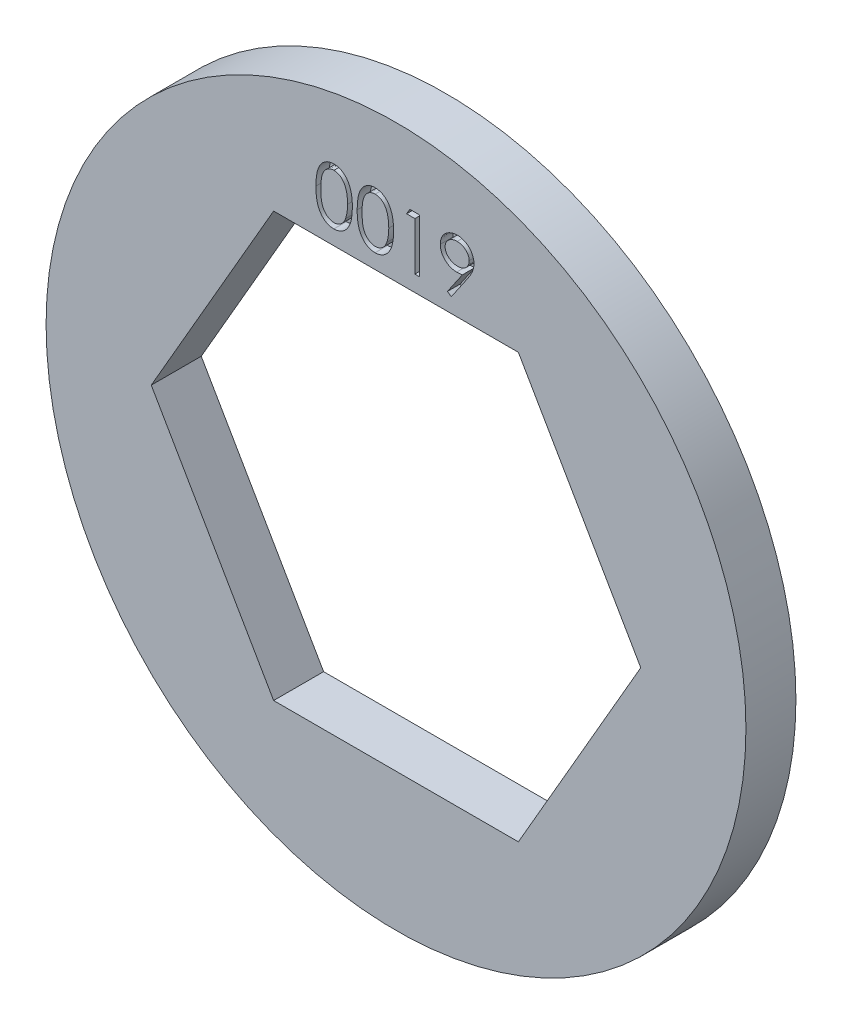
from build123d import *

# Parameters (mm, degrees)
SKETCH1_R           = 11.1125
BOSS_EXTRUDE1_DEPTH = 1.5875
CUT_EXTRUDE1_DEPTH  = 0.4


with BuildPart() as part:
    # Sketch1 → Boss-Extrude1 (new body)
    with BuildSketch(Plane.XY):
        Circle(SKETCH1_R)
        Polygon((7.772289324, 0), (3.886144662, 6.731), (-3.886144662, 6.731), (-7.772289324, 0), (-3.886144662, -6.731), (3.886144662, -6.731), align=None, mode=Mode.SUBTRACT)
    extrude(amount=BOSS_EXTRUDE1_DEPTH)

    # Sketch2 → Cut-Extrude1 (cut)
    # profile 1 of 4: a face of its own
    with BuildSketch(Plane.XY.offset(1.5875)):
        with BuildLine():
            add(Edge.make_bspline(
                [(-2.542411944, 8.089218189), (-2.542252452, 8.116494342), (-2.541942637, 8.169478662), (-2.538496044, 8.246684291), (-2.532770537, 8.31911304), (-2.524924085, 8.386768374), (-2.515375538, 8.44966776), (-2.502628819, 8.507643106), (-2.488132983, 8.560962739), (-2.471332596, 8.609800533), (-2.452375619, 8.654814457), (-2.431742869, 8.69683686), (-2.408615507, 8.735804157), (-2.384315304, 8.772338297), (-2.357858601, 8.805841242), (-2.329998292, 8.836786123), (-2.299646992, 8.864457756), (-2.267836456, 8.88966691), (-2.234278679, 8.911765741), (-2.199930196, 8.931230803), (-2.164554585, 8.947859755), (-2.128055262, 8.960934654), (-2.090760287, 8.971734202), (-2.052539286, 8.979119502), (-2.01332915, 8.983766344), (-1.986863032, 8.984210596), (-1.97344075, 8.984435897)],
                knots=[0, 0, 0, 0, 1.646270934, 3.197905019, 4.663502075, 6.030701355, 7.308322542, 8.50163776, 9.611534131, 10.641858119, 11.616356847, 12.558055219, 13.465016945, 14.349605745, 15.204443733, 16.039544428, 16.859896111, 17.680448484, 18.487036065, 19.28249412, 20.06191084, 20.843045899, 21.620316918, 22.403196591, 23.190181807, 24, 24, 24, 24], degree=3))
            add(Edge.make_bspline(
                [(-1.97344075, 8.984435897), (-1.959906345, 8.984198708), (-1.932990672, 8.983727012), (-1.893197543, 8.979193445), (-1.854323724, 8.971670943), (-1.816534944, 8.961012339), (-1.779520801, 8.947789024), (-1.743570807, 8.931214893), (-1.708461661, 8.911921894), (-1.674751294, 8.889252033), (-1.642069628, 8.863976765), (-1.611219415, 8.835404677), (-1.582197849, 8.803824268), (-1.554640696, 8.769573421), (-1.529329778, 8.731995204), (-1.505225758, 8.691743205), (-1.483650807, 8.648113495), (-1.462871987, 8.601834032), (-1.44493648, 8.55162429), (-1.428761481, 8.497767299), (-1.415692158, 8.439626913), (-1.404805855, 8.377508176), (-1.396372271, 8.311182961), (-1.390229919, 8.240793442), (-1.386985274, 8.16629331), (-1.38637423, 8.115357051), (-1.386060662, 8.089218189)],
                knots=[0, 0, 0, 0, 0.810914788, 1.612654377, 2.396697861, 3.181598691, 3.963628158, 4.749916497, 5.551656086, 6.361998678, 7.18212741, 8.025565596, 8.878627764, 9.750805457, 10.657531673, 11.591944965, 12.560506719, 13.57287815, 14.630710178, 15.753379473, 16.941251878, 18.199788006, 19.531962791, 20.947069417, 22.433333509, 24, 24, 24, 24], degree=3))
            add(Edge.make_bspline(
                [(-1.386060662, 8.089218189), (-1.386377481, 8.063193336), (-1.38699479, 8.01248497), (-1.390193545, 7.938320052), (-1.396494402, 7.868304089), (-1.404376161, 7.802269162), (-1.415292461, 7.740490118), (-1.428714882, 7.682753174), (-1.443617944, 7.628808997), (-1.462014302, 7.57909951), (-1.482149373, 7.53293127), (-1.504056496, 7.489818769), (-1.527526665, 7.449380941), (-1.553096815, 7.411941464), (-1.580351586, 7.377235122), (-1.60987431, 7.345874535), (-1.640832768, 7.317104064), (-1.67361061, 7.291503338), (-1.707846718, 7.269095589), (-1.742835278, 7.249056238), (-1.779197095, 7.232897552), (-1.816108142, 7.219023), (-1.854096386, 7.208422997), (-1.893114474, 7.201093658), (-1.932963937, 7.195953323), (-1.959901761, 7.195561189), (-1.97344075, 7.195364103)],
                knots=[0, 0, 0, 0, 1.561518951, 3.042555995, 4.452378317, 5.7783523, 7.031515105, 8.214008947, 9.334062868, 10.386615937, 11.391082383, 12.354592575, 13.286541444, 14.194233754, 15.072674879, 15.931287219, 16.775624067, 17.606195743, 18.42308326, 19.229000347, 20.022332153, 20.807536673, 21.593273796, 22.3848459, 23.188221202, 24, 24, 24, 24], degree=3))
            add(Edge.make_bspline(
                [(-1.97344075, 7.195364103), (-1.986862659, 7.195590858), (-2.013328044, 7.196037975), (-2.052543557, 7.200663823), (-2.090606718, 7.208100934), (-2.127705352, 7.218514299), (-2.164029794, 7.231260701), (-2.199085069, 7.247867198), (-2.233260949, 7.266992546), (-2.266466254, 7.28877336), (-2.298077025, 7.313727429), (-2.328271141, 7.341327848), (-2.356290072, 7.372263368), (-2.382368501, 7.406045519), (-2.407153559, 7.442363508), (-2.429952512, 7.481713195), (-2.451040661, 7.523938553), (-2.470316459, 7.569312388), (-2.487406743, 7.618496804), (-2.502503026, 7.672054482), (-2.51442251, 7.730458136), (-2.524625022, 7.793238689), (-2.532854141, 7.860665916), (-2.538472184, 7.932776422), (-2.541944495, 8.009525273), (-2.542253284, 8.062169131), (-2.542411944, 8.089218189)],
                knots=[0, 0, 0, 0, 0.810891512, 1.598919785, 2.382837074, 3.152667961, 3.926044502, 4.706494248, 5.493654104, 6.291793342, 7.103789334, 7.925228297, 8.761435821, 9.622817696, 10.50288917, 11.416980706, 12.369136599, 13.353924996, 14.394355917, 15.514179734, 16.714354668, 17.994756427, 19.357759367, 20.818452758, 22.365282078, 24, 24, 24, 24], degree=3))
        make_face()
        with BuildLine():
            add(Edge.make_bspline(
                [(-2.389686303, 8.0899), (-2.389628225, 8.067169447), (-2.389515505, 8.023053907), (-2.386570808, 7.958947946), (-2.382559309, 7.899156259), (-2.377385206, 7.843602925), (-2.369701361, 7.792475985), (-2.361091815, 7.7454238), (-2.350614518, 7.702695377), (-2.338218112, 7.663997509), (-2.324098474, 7.628673456), (-2.308682177, 7.595803814), (-2.29212088, 7.565000293), (-2.27358626, 7.53653958), (-2.25340045, 7.510328863), (-2.232019395, 7.485904224), (-2.208645131, 7.464122652), (-2.176309112, 7.43799912), (-2.133619957, 7.411004131), (-2.079833131, 7.387496881), (-2.024564283, 7.372724063), (-1.987051141, 7.370845394), (-1.968327169, 7.369907692)],
                knots=[0, 0, 0, 0, 1.459021318, 2.831673884, 4.118529203, 5.306027144, 6.411944654, 7.436330062, 8.375795394, 9.233974572, 10.042671642, 10.816086306, 11.563610507, 12.285937304, 12.993564865, 13.685989202, 14.367179055, 15.041617293, 16.353048772, 17.594441528, 18.799311195, 20, 20, 20, 20], degree=3))
            add(Edge.make_bspline(
                [(-1.968327169, 7.369907692), (-1.949482081, 7.370684579), (-1.911830815, 7.372236748), (-1.856821931, 7.387211974), (-1.803419316, 7.409806792), (-1.761568679, 7.436523839), (-1.729729196, 7.461967368), (-1.706916815, 7.483660285), (-1.685978816, 7.507950255), (-1.666120233, 7.534157633), (-1.64790656, 7.562783116), (-1.631344089, 7.593689057), (-1.616230477, 7.626961278), (-1.607619833, 7.65018829), (-1.603217433, 7.662063662)],
                knots=[0, 0, 0, 0, 1.353760809, 2.704726607, 4.075137775, 5.516104923, 6.260822281, 7.007110065, 7.778089737, 8.566572457, 9.372053459, 10.217411131, 11.088608312, 12, 12, 12, 12], degree=3))
            add(Edge.make_bspline(
                [(-1.603217433, 7.662063662), (-1.598086862, 7.677248453), (-1.587669603, 7.708080093), (-1.574243969, 7.755907311), (-1.563670735, 7.806087443), (-1.554158467, 7.858320604), (-1.54766583, 7.912991999), (-1.542439936, 7.969932469), (-1.539361775, 8.029184945), (-1.538980207, 8.069442235), (-1.538786303, 8.0899)],
                knots=[0, 0, 0, 0, 0.884706709, 1.796334032, 2.740027952, 3.714592787, 4.726048262, 5.777819803, 6.87074269, 8, 8, 8, 8], degree=3))
            add(Edge.make_bspline(
                [(-1.538786303, 8.0899), (-1.539053821, 8.110354456), (-1.539577143, 8.150367744), (-1.541577481, 8.208967126), (-1.546742967, 8.264624622), (-1.552480035, 8.317580006), (-1.560939061, 8.367540139), (-1.570059643, 8.414923261), (-1.582313192, 8.459142358), (-1.595402356, 8.50088974), (-1.610383251, 8.539691098), (-1.62687405, 8.575727339), (-1.644486104, 8.609172437), (-1.663615425, 8.639934632), (-1.684034926, 8.668151712), (-1.706283554, 8.693257928), (-1.729478783, 8.7160314), (-1.761967208, 8.742026428), (-1.804499707, 8.768531572), (-1.85742357, 8.792923598), (-1.912498994, 8.806931013), (-1.949731195, 8.808905921), (-1.968327169, 8.809892308)],
                knots=[0, 0, 0, 0, 1.31362396, 2.569729283, 3.763502607, 4.902122613, 5.988968491, 7.01645872, 7.998833611, 8.933434873, 9.825090667, 10.667526885, 11.477055099, 12.250526234, 12.991942729, 13.710640831, 14.402115721, 15.076753259, 16.378508321, 17.609869233, 18.806226677, 20, 20, 20, 20], degree=3))
            add(Edge.make_bspline(
                [(-1.968327169, 8.809892308), (-1.987149364, 8.80890456), (-2.024828046, 8.806927266), (-2.080475911, 8.792975786), (-2.133817301, 8.768658053), (-2.176237328, 8.74193864), (-2.208748412, 8.716490257), (-2.231641363, 8.694422067), (-2.253106493, 8.670282639), (-2.272880291, 8.643830874), (-2.291400388, 8.615403342), (-2.308409156, 8.584776405), (-2.323733782, 8.551794858), (-2.337875515, 8.516486672), (-2.350309735, 8.477792143), (-2.360566223, 8.435116351), (-2.370041385, 8.388213823), (-2.376749038, 8.336809977), (-2.382712027, 8.281242729), (-2.386544163, 8.221301775), (-2.389525356, 8.1570883), (-2.38963158, 8.112744663), (-2.389686303, 8.0899)],
                knots=[0, 0, 0, 0, 1.207732386, 2.417664972, 3.655092373, 4.956220595, 5.625982001, 6.301752483, 6.994047911, 7.697131622, 8.419323945, 9.170223765, 9.943494443, 10.752040957, 11.610060368, 12.549350801, 13.567764191, 14.679664412, 15.874934091, 17.154273443, 18.533957287, 20, 20, 20, 20], degree=3))
        make_face(mode=Mode.SUBTRACT)
    # profile 2 of 4: a face of its own
    with BuildSketch(Plane.XY.offset(1.5875)):
        with BuildLine():
            add(Edge.make_bspline(
                [(-1.233335021, 8.089218189), (-1.233175529, 8.116494342), (-1.232865714, 8.169478662), (-1.229419121, 8.246684291), (-1.223693614, 8.31911304), (-1.215847162, 8.386768374), (-1.206298615, 8.44966776), (-1.193551896, 8.507643106), (-1.17905606, 8.560962739), (-1.162255673, 8.609800533), (-1.143298696, 8.654814457), (-1.122665946, 8.69683686), (-1.099538584, 8.735804157), (-1.075238381, 8.772338297), (-1.048781678, 8.805841242), (-1.020921368, 8.836786123), (-0.990570069, 8.864457756), (-0.958759533, 8.88966691), (-0.925201756, 8.911765741), (-0.890853273, 8.931230803), (-0.855477662, 8.947859755), (-0.818978339, 8.960934654), (-0.781683364, 8.971734202), (-0.743462362, 8.979119502), (-0.704252227, 8.983766344), (-0.677786108, 8.984210596), (-0.664363827, 8.984435897)],
                knots=[0, 0, 0, 0, 1.646270934, 3.197905019, 4.663502075, 6.030701355, 7.308322542, 8.50163776, 9.611534131, 10.641858119, 11.616356847, 12.558055219, 13.465016945, 14.349605745, 15.204443733, 16.039544428, 16.859896111, 17.680448484, 18.487036065, 19.28249412, 20.06191084, 20.843045899, 21.620316918, 22.403196591, 23.190181807, 24, 24, 24, 24], degree=3))
            add(Edge.make_bspline(
                [(-0.664363827, 8.984435897), (-0.650829422, 8.984198708), (-0.623913749, 8.983727012), (-0.58412062, 8.979193445), (-0.545246801, 8.971670943), (-0.507458021, 8.961012339), (-0.470443878, 8.947789024), (-0.434493884, 8.931214893), (-0.399384738, 8.911921894), (-0.365674371, 8.889252033), (-0.332992705, 8.863976765), (-0.302142492, 8.835404677), (-0.273120926, 8.803824268), (-0.245563773, 8.769573421), (-0.220252854, 8.731995204), (-0.196148835, 8.691743205), (-0.174573884, 8.648113495), (-0.153795064, 8.601834032), (-0.135859557, 8.55162429), (-0.119684558, 8.497767299), (-0.106615235, 8.439626913), (-0.095728931, 8.377508176), (-0.087295347, 8.311182961), (-0.081152996, 8.240793442), (-0.077908351, 8.16629331), (-0.077297307, 8.115357051), (-0.076983739, 8.089218189)],
                knots=[0, 0, 0, 0, 0.810914788, 1.612654377, 2.396697861, 3.181598691, 3.963628158, 4.749916497, 5.551656086, 6.361998678, 7.18212741, 8.025565596, 8.878627764, 9.750805457, 10.657531673, 11.591944965, 12.560506719, 13.57287815, 14.630710178, 15.753379473, 16.941251878, 18.199788006, 19.531962791, 20.947069417, 22.433333509, 24, 24, 24, 24], degree=3))
            add(Edge.make_bspline(
                [(-0.076983739, 8.089218189), (-0.077300558, 8.063193336), (-0.077917867, 8.01248497), (-0.081116622, 7.938320052), (-0.087417479, 7.868304089), (-0.095299238, 7.802269162), (-0.106215538, 7.740490118), (-0.119637959, 7.682753174), (-0.134541021, 7.628808997), (-0.152937379, 7.57909951), (-0.17307245, 7.53293127), (-0.194979573, 7.489818769), (-0.218449742, 7.449380941), (-0.244019892, 7.411941464), (-0.271274663, 7.377235122), (-0.300797387, 7.345874535), (-0.331755845, 7.317104064), (-0.364533687, 7.291503338), (-0.398769795, 7.269095589), (-0.433758354, 7.249056238), (-0.470120172, 7.232897552), (-0.507031219, 7.219023), (-0.545019463, 7.208422997), (-0.58403755, 7.201093658), (-0.623887014, 7.195953323), (-0.650824838, 7.195561189), (-0.664363827, 7.195364103)],
                knots=[0, 0, 0, 0, 1.561518951, 3.042555995, 4.452378317, 5.7783523, 7.031515105, 8.214008947, 9.334062868, 10.386615937, 11.391082383, 12.354592575, 13.286541444, 14.194233754, 15.072674879, 15.931287219, 16.775624067, 17.606195743, 18.42308326, 19.229000347, 20.022332153, 20.807536673, 21.593273796, 22.3848459, 23.188221202, 24, 24, 24, 24], degree=3))
            add(Edge.make_bspline(
                [(-0.664363827, 7.195364103), (-0.677785736, 7.195590858), (-0.704251121, 7.196037975), (-0.743466634, 7.200663823), (-0.781529795, 7.208100934), (-0.818628429, 7.218514299), (-0.854952871, 7.231260701), (-0.890008146, 7.247867198), (-0.924184026, 7.266992546), (-0.957389331, 7.28877336), (-0.989000102, 7.313727429), (-1.019194218, 7.341327848), (-1.047213148, 7.372263368), (-1.073291578, 7.406045519), (-1.098076636, 7.442363508), (-1.120875589, 7.481713195), (-1.141963738, 7.523938553), (-1.161239535, 7.569312388), (-1.17832982, 7.618496804), (-1.193426103, 7.672054482), (-1.205345586, 7.730458136), (-1.215548099, 7.793238689), (-1.223777217, 7.860665916), (-1.229395261, 7.932776422), (-1.232867572, 8.009525273), (-1.233176361, 8.062169131), (-1.233335021, 8.089218189)],
                knots=[0, 0, 0, 0, 0.810891512, 1.598919785, 2.382837074, 3.152667961, 3.926044502, 4.706494248, 5.493654104, 6.291793342, 7.103789334, 7.925228297, 8.761435821, 9.622817696, 10.50288917, 11.416980706, 12.369136599, 13.353924996, 14.394355917, 15.514179734, 16.714354668, 17.994756427, 19.357759367, 20.818452758, 22.365282078, 24, 24, 24, 24], degree=3))
        make_face()
        with BuildLine():
            add(Edge.make_bspline(
                [(-1.08060938, 8.0899), (-1.080551302, 8.067169447), (-1.080438582, 8.023053907), (-1.077493885, 7.958947946), (-1.073482386, 7.899156259), (-1.068308283, 7.843602925), (-1.060624438, 7.792475985), (-1.052014892, 7.7454238), (-1.041537595, 7.702695377), (-1.029141189, 7.663997509), (-1.015021551, 7.628673456), (-0.999605254, 7.595803814), (-0.983043957, 7.565000293), (-0.964509337, 7.53653958), (-0.944323527, 7.510328863), (-0.922942472, 7.485904224), (-0.899568208, 7.464122652), (-0.867232189, 7.43799912), (-0.824543034, 7.411004131), (-0.770756208, 7.387496881), (-0.71548736, 7.372724063), (-0.677974218, 7.370845394), (-0.659250245, 7.369907692)],
                knots=[0, 0, 0, 0, 1.459021318, 2.831673884, 4.118529203, 5.306027144, 6.411944654, 7.436330062, 8.375795394, 9.233974572, 10.042671642, 10.816086306, 11.563610507, 12.285937304, 12.993564865, 13.685989202, 14.367179055, 15.041617293, 16.353048772, 17.594441528, 18.799311195, 20, 20, 20, 20], degree=3))
            add(Edge.make_bspline(
                [(-0.659250245, 7.369907692), (-0.640405158, 7.370684579), (-0.602753892, 7.372236748), (-0.547745008, 7.387211974), (-0.494342393, 7.409806792), (-0.452491756, 7.436523839), (-0.420652273, 7.461967368), (-0.397839891, 7.483660285), (-0.376901893, 7.507950255), (-0.357043309, 7.534157633), (-0.338829637, 7.562783116), (-0.322267166, 7.593689057), (-0.307153554, 7.626961278), (-0.29854291, 7.65018829), (-0.29414051, 7.662063662)],
                knots=[0, 0, 0, 0, 1.353760809, 2.704726607, 4.075137775, 5.516104923, 6.260822281, 7.007110065, 7.778089737, 8.566572457, 9.372053459, 10.217411131, 11.088608312, 12, 12, 12, 12], degree=3))
            add(Edge.make_bspline(
                [(-0.29414051, 7.662063662), (-0.289009939, 7.677248453), (-0.27859268, 7.708080093), (-0.265167046, 7.755907311), (-0.254593812, 7.806087443), (-0.245081544, 7.858320604), (-0.238588907, 7.912991999), (-0.233363013, 7.969932469), (-0.230284852, 8.029184945), (-0.229903284, 8.069442235), (-0.22970938, 8.0899)],
                knots=[0, 0, 0, 0, 0.884706709, 1.796334032, 2.740027952, 3.714592787, 4.726048262, 5.777819803, 6.87074269, 8, 8, 8, 8], degree=3))
            add(Edge.make_bspline(
                [(-0.22970938, 8.0899), (-0.229976898, 8.110354456), (-0.23050022, 8.150367744), (-0.232500558, 8.208967126), (-0.237666043, 8.264624622), (-0.243403112, 8.317580006), (-0.251862138, 8.367540139), (-0.26098272, 8.414923261), (-0.273236269, 8.459142358), (-0.286325433, 8.50088974), (-0.301306328, 8.539691098), (-0.317797127, 8.575727339), (-0.335409181, 8.609172437), (-0.354538502, 8.639934632), (-0.374958003, 8.668151712), (-0.397206631, 8.693257928), (-0.42040186, 8.7160314), (-0.452890285, 8.742026428), (-0.495422784, 8.768531572), (-0.548346647, 8.792923598), (-0.603422071, 8.806931013), (-0.640654272, 8.808905921), (-0.659250245, 8.809892308)],
                knots=[0, 0, 0, 0, 1.31362396, 2.569729283, 3.763502607, 4.902122613, 5.988968491, 7.01645872, 7.998833611, 8.933434873, 9.825090667, 10.667526885, 11.477055099, 12.250526234, 12.991942729, 13.710640831, 14.402115721, 15.076753259, 16.378508321, 17.609869233, 18.806226677, 20, 20, 20, 20], degree=3))
            add(Edge.make_bspline(
                [(-0.659250245, 8.809892308), (-0.678072441, 8.80890456), (-0.715751123, 8.806927266), (-0.771398988, 8.792975786), (-0.824740378, 8.768658053), (-0.867160405, 8.74193864), (-0.899671489, 8.716490257), (-0.922564439, 8.694422067), (-0.94402957, 8.670282639), (-0.963803367, 8.643830874), (-0.982323465, 8.615403342), (-0.999332233, 8.584776405), (-1.014656859, 8.551794858), (-1.028798592, 8.516486672), (-1.041232812, 8.477792143), (-1.051489299, 8.435116351), (-1.060964461, 8.388213823), (-1.067672115, 8.336809977), (-1.073635104, 8.281242729), (-1.07746724, 8.221301775), (-1.080448433, 8.1570883), (-1.080554657, 8.112744663), (-1.08060938, 8.0899)],
                knots=[0, 0, 0, 0, 1.207732386, 2.417664972, 3.655092373, 4.956220595, 5.625982001, 6.301752483, 6.994047911, 7.697131622, 8.419323945, 9.170223765, 9.943494443, 10.752040957, 11.610060368, 12.549350801, 13.567764191, 14.679664412, 15.874934091, 17.154273443, 18.533957287, 20, 20, 20, 20], degree=3))
        make_face(mode=Mode.SUBTRACT)
    # profile 3 of 4: a face of its own
    with BuildSketch(Plane.XY.offset(1.5875)):
        Polygon((0.437442583, 8.9408), (0.752098312, 8.9408), (0.752098312, 7.239), (0.599372671, 7.239), (0.599372671, 8.76625641), (0.337557287, 8.76625641), align=None)
    # profile 4 of 4: a face of its own
    with BuildSketch(Plane.XY.offset(1.5875)):
        with BuildLine():
            Line((1.755723953, 7.195364103), (1.633679803, 7.280249559))
            Line((1.633679803, 7.280249559), (2.106856565, 7.971946715))
            add(Edge.make_bspline(
                [(2.106856565, 7.971946715), (2.076666276, 7.96825475), (2.017219912, 7.960985067), (1.957347135, 7.959649565), (1.927881205, 7.958992308)],
                knots=[0, 0, 0, 0, 1.015715272, 2, 2, 2, 2], degree=3))
            add(Edge.make_bspline(
                [(1.927881205, 7.958992308), (1.910016171, 7.959449886), (1.874948673, 7.960348072), (1.823393054, 7.967467338), (1.773853384, 7.978431854), (1.726460998, 7.99479284), (1.681037766, 8.015126048), (1.637682848, 8.04034041), (1.596454608, 8.070003412), (1.557795834, 8.103958208), (1.5226358, 8.141241267), (1.491311352, 8.18070146), (1.465278124, 8.22279717), (1.443652338, 8.266669681), (1.427251627, 8.312949573), (1.41530862, 8.361110222), (1.407955699, 8.411489162), (1.407080927, 8.445780496), (1.406636774, 8.463191466)],
                knots=[0, 0, 0, 0, 1.060718605, 2.082097864, 3.085795603, 4.069760067, 5.054557537, 6.03741023, 7.043284206, 8.066802108, 9.088538119, 10.083643548, 11.053783639, 12.022749082, 12.983451788, 13.964007469, 14.966251758, 16, 16, 16, 16], degree=3))
            add(Edge.make_bspline(
                [(1.406636774, 8.463191466), (1.407480106, 8.487001424), (1.409135395, 8.533735542), (1.422457337, 8.602018453), (1.444366961, 8.666583064), (1.474915913, 8.727259622), (1.513393475, 8.783175295), (1.559637989, 8.833552761), (1.613368174, 8.877675501), (1.673360037, 8.915603312), (1.738200086, 8.946106861), (1.806110978, 8.96858973), (1.876572363, 8.981814538), (1.924304289, 8.983558086), (1.948335532, 8.984435897)],
                knots=[0, 0, 0, 0, 1.022988612, 2.007919123, 2.978103895, 3.94594894, 4.918897164, 5.887013414, 6.875921846, 7.89917871, 8.930658928, 9.948724884, 10.967259574, 12, 12, 12, 12], degree=3))
            add(Edge.make_bspline(
                [(1.948335532, 8.984435897), (1.971911987, 8.98354602), (2.01849684, 8.981787706), (2.0870011, 8.968910443), (2.152613278, 8.947206818), (2.214969655, 8.91721402), (2.272704149, 8.879618386), (2.3246216, 8.834819948), (2.369537226, 8.782790803), (2.40737742, 8.724789331), (2.437752139, 8.662470883), (2.45966757, 8.597421317), (2.473158293, 8.530108456), (2.474858307, 8.484502903), (2.475716261, 8.461486939)],
                knots=[0, 0, 0, 0, 1.026385292, 2.028040595, 3.023318987, 4.028184125, 5.03290303, 6.015178782, 7.004435299, 8.016004309, 9.023023918, 10.015172535, 10.998308025, 12, 12, 12, 12], degree=3))
            add(Edge.make_bspline(
                [(2.475716261, 8.461486939), (2.475143285, 8.44362107), (2.473981146, 8.407384623), (2.465843475, 8.352328795), (2.452024769, 8.296193108), (2.436343072, 8.248678076), (2.421205723, 8.209435322), (2.406958675, 8.178437483), (2.391150337, 8.145810931), (2.37271315, 8.111897783), (2.352893357, 8.07626572), (2.330498021, 8.03927213), (2.306038014, 8.00086737), (2.288616581, 7.974977114), (2.279695628, 7.961719551)],
                knots=[0, 0, 0, 0, 1.179839688, 2.393009684, 3.667231171, 4.993948276, 5.694988576, 6.444077775, 7.246288328, 8.089075292, 8.993003841, 9.939041771, 10.944649915, 12, 12, 12, 12], degree=3))
            Line((2.279695628, 7.961719551), (1.755723953, 7.195364103))
        make_face()
        with BuildLine():
            add(Edge.make_bspline(
                [(1.956176357, 8.133535897), (1.96971005, 8.133905618), (1.996055549, 8.134625338), (2.03465106, 8.139005888), (2.071081348, 8.146772897), (2.105443729, 8.157917116), (2.138082747, 8.171364578), (2.168479972, 8.188485652), (2.196660844, 8.20891534), (2.222814071, 8.231870199), (2.246038292, 8.257373171), (2.266723929, 8.284065713), (2.28430623, 8.312064995), (2.298194511, 8.341721662), (2.309613383, 8.372313807), (2.317499044, 8.404334076), (2.321867483, 8.437615644), (2.322612179, 8.46022462), (2.32299062, 8.471714103)],
                knots=[0, 0, 0, 0, 1.163407946, 2.26475976, 3.333800367, 4.359385343, 5.366239384, 6.363380779, 7.350133999, 8.353570782, 9.349036268, 10.310270964, 11.253520213, 12.184142, 13.120487599, 14.056272588, 15.012232024, 16, 16, 16, 16], degree=3))
            add(Edge.make_bspline(
                [(2.32299062, 8.471714103), (2.322665008, 8.483208383), (2.322023349, 8.505859273), (2.316875501, 8.539190115), (2.307819385, 8.571132056), (2.295668298, 8.601859965), (2.279661538, 8.631121382), (2.260453814, 8.659283678), (2.237633916, 8.68616829), (2.211376325, 8.711142927), (2.183061022, 8.734164828), (2.152885434, 8.754482412), (2.121098282, 8.771510719), (2.087893494, 8.785562223), (2.053201888, 8.796527541), (2.017043993, 8.804412887), (1.979237093, 8.808775211), (1.953573324, 8.809515199), (1.940494706, 8.809892308)],
                knots=[0, 0, 0, 0, 0.972161553, 1.915763587, 2.844109794, 3.775983486, 4.705125789, 5.659731448, 6.655561913, 7.682237399, 8.721216875, 9.739758359, 10.754845918, 11.767244016, 12.7857855, 13.828538656, 14.893392813, 16, 16, 16, 16], degree=3))
            add(Edge.make_bspline(
                [(1.940494706, 8.809892308), (1.927529833, 8.80951459), (1.902092859, 8.808773511), (1.864622063, 8.804421179), (1.828708653, 8.79647451), (1.794117564, 8.785567303), (1.760913763, 8.77150967), (1.729128111, 8.75448152), (1.698945464, 8.734169505), (1.670657308, 8.711124813), (1.644353352, 8.686284539), (1.621925802, 8.659165905), (1.602674121, 8.631136031), (1.586689355, 8.601856072), (1.574532417, 8.571133095), (1.565477867, 8.539189834), (1.560329599, 8.505859346), (1.559687998, 8.483208408), (1.559362415, 8.471714103)],
                knots=[0, 0, 0, 0, 1.099389452, 2.15699305, 3.192601482, 4.213358962, 5.227959689, 6.245255729, 7.266013209, 8.307253147, 9.336162325, 10.327954924, 11.284637477, 12.215801273, 13.149702402, 14.080068371, 15.025723358, 16, 16, 16, 16], degree=3))
            add(Edge.make_bspline(
                [(1.559362415, 8.471714103), (1.559657033, 8.460215673), (1.560238075, 8.437538664), (1.565843216, 8.404219174), (1.575216866, 8.372279698), (1.587770992, 8.341409674), (1.604303536, 8.311909283), (1.624590863, 8.283918387), (1.648370137, 8.257119681), (1.675323483, 8.231929534), (1.704822076, 8.208808308), (1.736328105, 8.188615049), (1.769299185, 8.171561825), (1.803851381, 8.15787868), (1.839728631, 8.146884243), (1.877253385, 8.139020203), (1.916301544, 8.134667355), (1.942757232, 8.133916668), (1.956176357, 8.133535897)],
                knots=[0, 0, 0, 0, 0.952633368, 1.87876736, 2.791047057, 3.707742249, 4.635551637, 5.587206343, 6.568248508, 7.601284464, 8.641511608, 9.671105535, 10.699146789, 11.713763218, 12.747829548, 13.806491675, 14.887386225, 16, 16, 16, 16], degree=3))
        make_face(mode=Mode.SUBTRACT)
    extrude(amount=-CUT_EXTRUDE1_DEPTH, mode=Mode.SUBTRACT)


solid = part.part
